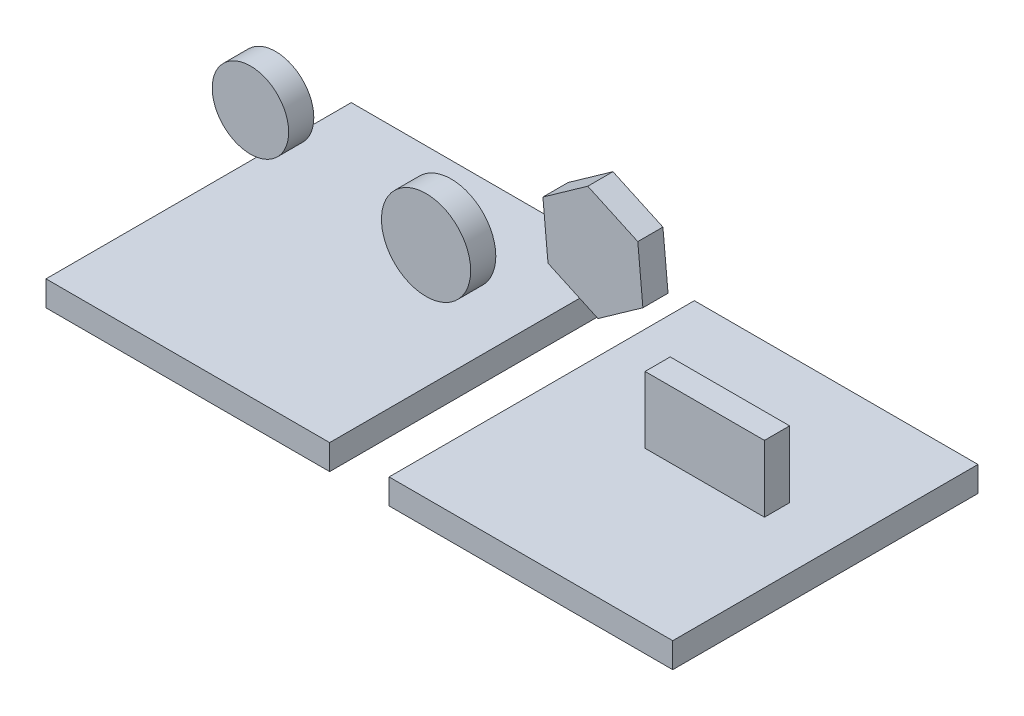
from build123d import *

# Parameters (mm, degrees)
SKETCH1_W             = 249.220426788
SKETCH1_H             = 121.383255676
BOSS_EXTRUDE1_DEPTH   = 10
SKETCH2_W             = 23.635852348
SKETCH2_H             = 158.79506956
CUT_EXTRUDE1_DEPTH    = 139.96466807
SKETCH3_R             = 15.19844863
BOSS_EXTRUDE2_DEPTH   = 10
SKETCH3_R_2           = 17.73502646
BOSS_EXTRUDE2_2_DEPTH = 10
BOSS_EXTRUDE2_3_DEPTH = 10
SKETCH3_W             = 47.480785839
SKETCH3_H             = 26.469909154
BOSS_EXTRUDE2_4_DEPTH = 10


with BuildPart() as part:
    # Sketch1 → Boss-Extrude1 (new body)
    with BuildSketch(Plane(origin=(0, 0, 0), x_dir=(1, 0, 0), z_dir=(0, 1, 0))):
        Rectangle(SKETCH1_W, SKETCH1_H)
    extrude(amount=BOSS_EXTRUDE1_DEPTH)

    # Sketch2 → Cut-Extrude1 (cut, through all)
    with BuildSketch(Plane(origin=(0, 10, 0), x_dir=(1, 0, 0), z_dir=(0, 1, 0))):
        Rectangle(SKETCH2_W, SKETCH2_H)
    extrude(amount=-CUT_EXTRUDE1_DEPTH, mode=Mode.SUBTRACT)


with BuildPart() as cut_extrude1_piece_1:
    # of the separate pieces the step leaves, piece 1, a body of its own (cut_extrude1_pieces)
    add(part.part.solids().sort_by_distance((-124.610213394, 0, 60.691627838))[0])


with BuildPart() as cut_extrude1_piece_2:
    # of the separate pieces the step leaves, piece 2, a body of its own (cut_extrude1_pieces)
    add(part.part.solids().sort_by_distance((11.817926174, 0, 60.691627838))[0])


with BuildPart() as body_3:
    # Sketch3 → Boss-Extrude2 (new body)
    with BuildSketch(Plane.XY):
        with Locations((-94.006230926, 58.075790121)):
            Circle(SKETCH3_R)
    extrude(amount=BOSS_EXTRUDE2_DEPTH)


with BuildPart() as body_4:
    # Sketch3 → Boss-Extrude2 2 (new body)
    with BuildSketch(Plane.XY):
        with Locations((-24.173030809, 46.526453179)):
            Circle(SKETCH3_R_2)
    extrude(amount=BOSS_EXTRUDE2_2_DEPTH)


with BuildPart() as body_5:
    # Sketch3 → Boss-Extrude2 3 (new body)
    with BuildSketch(Plane.XY):
        Polygon((62.044112411, 68.013591676), (60.014884168, 89.792385816), (40.139281058, 98.924419677), (22.292906191, 86.277659399), (24.322134434, 64.498865259), (44.197737544, 55.366831398), align=None)
    extrude(amount=BOSS_EXTRUDE2_3_DEPTH)


with BuildPart() as body_6:
    # Sketch3 → Boss-Extrude2 4 (new body)
    with BuildSketch(Plane.XY):
        with Locations((86.649781111, 33.291498602)):
            Rectangle(SKETCH3_W, SKETCH3_H)
    extrude(amount=BOSS_EXTRUDE2_4_DEPTH)


solid = Compound([cut_extrude1_piece_1.part, cut_extrude1_piece_2.part, body_3.part, body_4.part, body_5.part, body_6.part])
